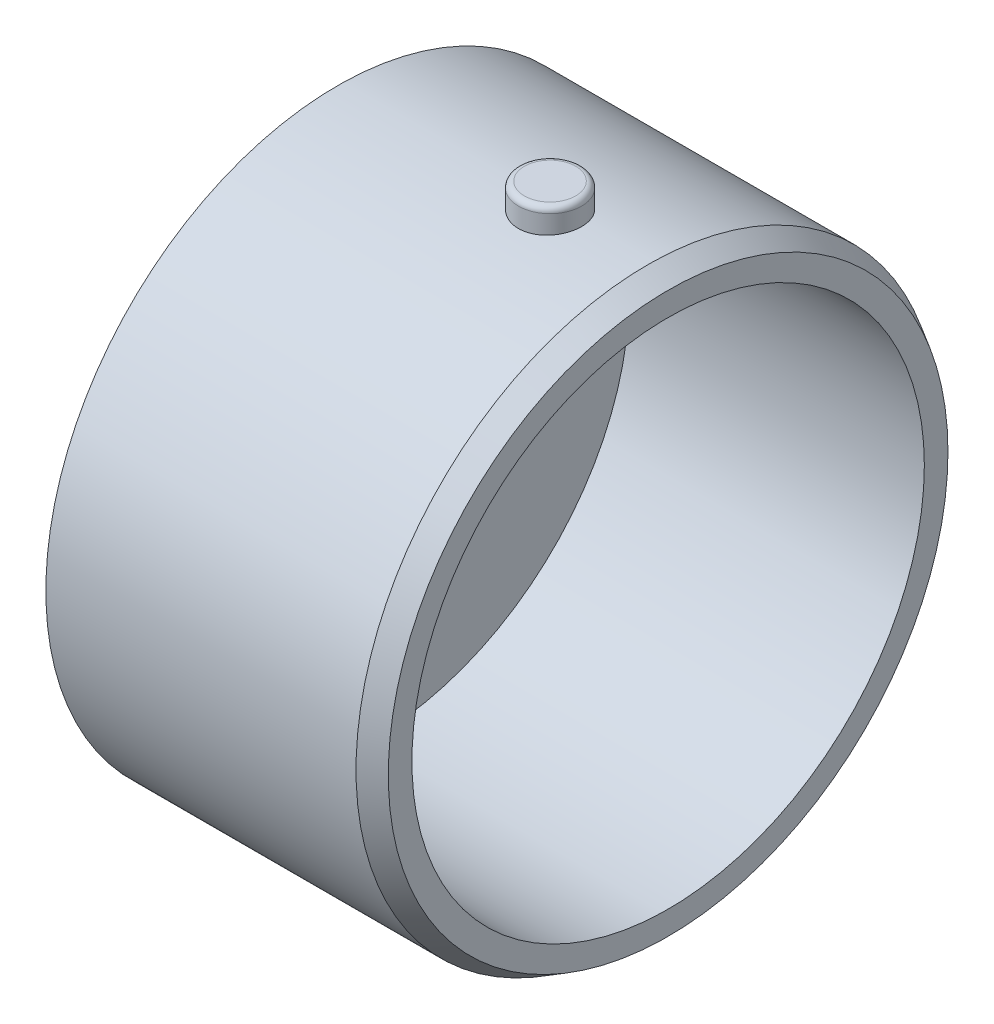
from build123d import *

# Parameters (mm, degrees)
SKETCH1_R                                    = 24.7
SKETCH1_R_2                                  = 21.7
BOSS_EXTRUDE1_DEPTH                          = 25
BOSS_EXTRUDE2_START                          = -3
SKETCH1_2_R                                  = 24.7
BOSS_EXTRUDE2_DEPTH                          = 3
FILLET1_R                                    = 0.5
CHAMFER1_SIZE                                = 1
CHAMFER1_SIZE2                               = 1.732050808
CSK_FOR_M5_COUNTERSUNK_FLAT_HEAD_SCR_2_COUNT = 2
CSK_FOR_M5_COUNTERSUNK_FLAT_HEAD_SCR_2_PITCH = 25
SKETCH7_W                                    = 1.730769231
SKETCH7_H                                    = 0.833333334
CUT_EXTRUDE1_DEPTH                           = 1


with BuildPart() as part:
    # Sketch1 → Boss-Extrude1 (new body)
    with BuildSketch(Plane.YZ):
        Circle(SKETCH1_R)
        Circle(SKETCH1_R_2, mode=Mode.SUBTRACT)
    extrude(amount=BOSS_EXTRUDE1_DEPTH)

    # Sketch1<2> → Boss-Extrude2 (add)
    with BuildSketch(Plane.YZ.offset(BOSS_EXTRUDE2_START)):
        Circle(SKETCH1_2_R)
    extrude(amount=BOSS_EXTRUDE2_DEPTH)

    # Sketch3 → Revolve1 (revolve)
    with BuildSketch(Plane(origin=(0, 0, 0), x_dir=(0, 1, 0), z_dir=(0, 0, 1))):
        Polygon((-26.7, -15), (-26.7, -17.675), (-24.7, -17.675), (-23.7, -17.675), (-23.7, -15), (-24.7, -15), align=None)
    revolve1 = revolve(axis=Axis((15, -32.98317824, 0), (0, 1, 0)))

    # Mirror1: Revolve1 across plane
    add(revolve1.mirror(Plane.ZX))

    # Fillet1
    fillet1_edges = [part.edges().sort_by_distance(p)[0] for p in [
        (12.325, 26.7, 0),
        (12.325, -26.7, 0),
    ]]
    fillet(fillet1_edges, radius=FILLET1_R)

    # Chamfer1
    chamfer1_edges = [part.edges().sort_by_distance(p)[0] for p in [
        (25, -24.7, 0),
    ]]
    chamfer1_side = [part.faces().sort_by_distance(p)[0] for p in [
        (25, -24.0013785, 0),
    ]]
    chamfer(chamfer1_edges, length=CHAMFER1_SIZE, length2=CHAMFER1_SIZE2, reference=chamfer1_side[0])

    # Sketch5 → CSK for M5 Countersunk Flat Head Screw1 (revolve, cut)
    with BuildSketch(Plane(origin=(0, -12.5, 0), x_dir=(0, 0, -1), z_dir=(0, 1, 0))):
        Polygon((0, 0), (0, 3), (2.125, 3), (2.125, 1.375), (3.5, 0), align=None)
    csk_for_m5_countersunk_flat_head_screw1 = revolve(axis=Axis((6.35, -12.5, 0), (-1, 0, 0)), mode=Mode.SUBTRACT)

    # CSK for M5 Countersunk Flat Head Scr 2: CSK for M5 Countersunk Flat Head Screw1 ×2
    with Locations(*[(0, i * CSK_FOR_M5_COUNTERSUNK_FLAT_HEAD_SCR_2_PITCH, 0) for i in range(1, CSK_FOR_M5_COUNTERSUNK_FLAT_HEAD_SCR_2_COUNT)]):
        add(csk_for_m5_countersunk_flat_head_screw1, mode=Mode.SUBTRACT)

    # Sketch7 → Cut-Extrude1 (cut)
    # profile 1 of 9: a face of its own
    with BuildSketch(Plane.YZ):
        Polygon((-14.943457021, 10), (-11.738328816, 10), (-11.738328816, 9.534254808), (-13.943857662, 4.871794872), (-14.738128495, 5.272435897), (-12.89618138, 9.166666667), (-14.943457021, 9.166666667), align=None)
    # profile 2 of 9: a face of its own
    with BuildSketch(Plane.YZ):
        with BuildLine():
            Line((-10.135764713, 8.782051282), (-11.033200611, 8.782051282))
            add(Edge.make_bspline(
                [(-11.033200611, 8.782051282), (-11.026864372, 8.826910901), (-11.014442596, 8.914855212), (-10.984718946, 9.042176667), (-10.949166254, 9.162949781), (-10.904780534, 9.276792089), (-10.852723305, 9.383906383), (-10.793523932, 9.484660227), (-10.726542447, 9.578621166), (-10.675200429, 9.635223608), (-10.649586829, 9.663461538)],
                knots=[0, 0, 0, 0, 1.111473889, 2.178970933, 3.205615836, 4.199322666, 5.174200091, 6.12565194, 7.064921805, 8, 8, 8, 8], degree=3))
            add(Edge.make_bspline(
                [(-10.649586829, 9.663461538), (-10.612642605, 9.700719441), (-10.539829422, 9.774150852), (-10.418150053, 9.868208379), (-10.290607603, 9.949608771), (-10.154644152, 10.014143591), (-10.012375395, 10.066377051), (-9.862669959, 10.101462385), (-9.706139597, 10.124741813), (-9.599327317, 10.127034918), (-9.5448192, 10.128205128)],
                knots=[0, 0, 0, 0, 1.01925491, 2.00884431, 2.983262333, 3.955970413, 4.92937149, 5.924503185, 6.940838805, 8, 8, 8, 8], degree=3))
            add(Edge.make_bspline(
                [(-9.5448192, 10.128205128), (-9.49635868, 10.12706107), (-9.401095062, 10.124812083), (-9.261081514, 10.106758433), (-9.127590313, 10.075094341), (-8.999210419, 10.033694252), (-8.87782988, 9.977362511), (-8.760769712, 9.911973351), (-8.651300579, 9.831770827), (-8.549166344, 9.741150047), (-8.45533657, 9.643134803), (-8.374079575, 9.538364567), (-8.304221478, 9.429637994), (-8.246667646, 9.316051772), (-8.20241657, 9.1974137), (-8.171705012, 9.074409134), (-8.151603551, 8.947309492), (-8.14960092, 8.860921577), (-8.148585226, 8.817107372)],
                knots=[0, 0, 0, 0, 1.091422571, 2.145516843, 3.172569842, 4.178562979, 5.178154469, 6.181868002, 7.194278174, 8.227918432, 9.254613415, 10.245994977, 11.209837596, 12.161663635, 13.10878368, 14.055455738, 15.013766427, 16, 16, 16, 16], degree=3))
            add(Edge.make_bspline(
                [(-8.148585226, 8.817107372), (-8.150669491, 8.762847127), (-8.154772767, 8.656025387), (-8.188443117, 8.499683833), (-8.241146372, 8.350193408), (-8.317281349, 8.209645707), (-8.412469462, 8.078423221), (-8.529262088, 7.960913113), (-8.664332671, 7.855272984), (-8.765731957, 7.798501965), (-8.817655739, 7.76943109)],
                knots=[0, 0, 0, 0, 0.992805628, 1.954529043, 2.915727527, 3.886831945, 4.871318353, 5.87440735, 6.911542536, 8, 8, 8, 8], degree=3))
            add(Edge.make_bspline(
                [(-8.817655739, 7.76943109), (-8.782016051, 7.75772983), (-8.711985664, 7.734737379), (-8.612445889, 7.689454008), (-8.517794937, 7.639966789), (-8.429662663, 7.582475686), (-8.347172486, 7.519305383), (-8.270827276, 7.44991588), (-8.200170886, 7.374458477), (-8.136356756, 7.292518186), (-8.079719221, 7.205405484), (-8.028901378, 7.115132622), (-7.98707546, 7.020330597), (-7.9516437, 6.92208211), (-7.924667975, 6.819504157), (-7.905674655, 6.712994218), (-7.894696049, 6.60279525), (-7.893021625, 6.528135516), (-7.89217497, 6.490384615)],
                knots=[0, 0, 0, 0, 1.059543567, 2.081955587, 3.086750234, 4.076226789, 5.052108497, 6.020845489, 6.989030705, 7.970690546, 8.952259656, 9.923888338, 10.895517021, 11.877585046, 12.873342345, 13.889638361, 14.932918083, 16, 16, 16, 16], degree=3))
            add(Edge.make_bspline(
                [(-7.89217497, 6.490384615), (-7.893891253, 6.434906119), (-7.897275414, 6.325513823), (-7.918790328, 6.164390166), (-7.958847221, 6.010773074), (-8.011544283, 5.862894951), (-8.081836444, 5.722664849), (-8.1645585, 5.586864679), (-8.266240528, 5.460203954), (-8.379242643, 5.339334092), (-8.504738079, 5.229444625), (-8.640795547, 5.134175403), (-8.784423262, 5.052417459), (-8.936529913, 4.986044031), (-9.097062657, 4.9349289), (-9.26566368, 4.897980528), (-9.443041397, 4.875374902), (-9.564115566, 4.873005131), (-9.625949008, 4.871794872)],
                knots=[0, 0, 0, 0, 1.005138573, 1.981928558, 2.936866704, 3.876260664, 4.820238198, 5.773547, 6.751179199, 7.756627054, 8.768222608, 9.766606018, 10.760583154, 11.757261445, 12.767156078, 13.807575856, 14.880313354, 16, 16, 16, 16], degree=3))
            add(Edge.make_bspline(
                [(-9.625949008, 4.871794872), (-9.684442447, 4.873070885), (-9.798818626, 4.875565961), (-9.966117726, 4.897162106), (-10.125119684, 4.931998439), (-10.276230277, 4.98110314), (-10.418864869, 5.044783546), (-10.554316927, 5.120612621), (-10.679883533, 5.212964009), (-10.796963749, 5.317668795), (-10.902960381, 5.43514162), (-10.997696408, 5.562661284), (-11.079082885, 5.700712692), (-11.147453578, 5.848706031), (-11.202273983, 6.006900926), (-11.245516158, 6.17497568), (-11.275721524, 6.353258657), (-11.284920632, 6.475921139), (-11.289610867, 6.538461538)],
                knots=[0, 0, 0, 0, 1.066544725, 2.085487077, 3.070979577, 4.031932826, 4.977951092, 5.916076795, 6.857635327, 7.814973522, 8.776389752, 9.738577119, 10.707772778, 11.69409279, 12.707140348, 13.757286496, 14.856535458, 16, 16, 16, 16], degree=3))
            Line((-11.289610867, 6.538461538), (-10.39217497, 6.538461538))
            add(Edge.make_bspline(
                [(-10.39217497, 6.538461538), (-10.386488012, 6.507015405), (-10.37541117, 6.445765812), (-10.35380647, 6.357090019), (-10.325652532, 6.275236784), (-10.293099575, 6.1994786), (-10.25793748, 6.128820787), (-10.215453261, 6.065872912), (-10.168759938, 6.008925684), (-10.101381133, 5.941226191), (-10.00505849, 5.871667788), (-9.874991011, 5.811218227), (-9.730303258, 5.775787358), (-9.629152089, 5.771464901), (-9.576870482, 5.769230769)],
                knots=[0, 0, 0, 0, 0.928156231, 1.807827665, 2.648129825, 3.438902246, 4.202261636, 4.936546065, 5.639352463, 6.338805438, 7.70633318, 9.064371875, 10.482673459, 12, 12, 12, 12], degree=3))
            add(Edge.make_bspline(
                [(-9.576870482, 5.769230769), (-9.549128014, 5.769706506), (-9.494786725, 5.770638369), (-9.414967464, 5.780966821), (-9.338928378, 5.797977789), (-9.266527842, 5.821095064), (-9.197304949, 5.850074014), (-9.132582272, 5.887440635), (-9.071040602, 5.930884667), (-9.013348951, 5.979727291), (-8.960040676, 6.032948268), (-8.915685057, 6.091881457), (-8.875147231, 6.151768111), (-8.845165162, 6.216526225), (-8.818894411, 6.282671121), (-8.802815369, 6.352603652), (-8.790674538, 6.42485682), (-8.789968962, 6.474303716), (-8.789610867, 6.499399038)],
                knots=[0, 0, 0, 0, 1.110435564, 2.175094844, 3.216326037, 4.226890168, 5.215276772, 6.21526065, 7.213097102, 8.228249917, 9.239874822, 10.221364777, 11.178138315, 12.128914389, 13.072518965, 14.022636769, 14.996447288, 16, 16, 16, 16], degree=3))
            add(Edge.make_bspline(
                [(-8.789610867, 6.499399038), (-8.790561541, 6.526845049), (-8.792454116, 6.581483766), (-8.807916646, 6.661217485), (-8.832335251, 6.737914897), (-8.866255675, 6.811236349), (-8.91155262, 6.880911593), (-8.965002511, 6.948338525), (-9.030816314, 7.010007694), (-9.10302287, 7.070965799), (-9.186754109, 7.124102882), (-9.277932202, 7.173140601), (-9.37895345, 7.212159487), (-9.487351834, 7.247010579), (-9.605177813, 7.272465275), (-9.731699729, 7.290947865), (-9.866713484, 7.304705289), (-9.95978022, 7.306679018), (-10.007559585, 7.307692308)],
                knots=[0, 0, 0, 0, 0.809814727, 1.612155564, 2.388397, 3.182215007, 3.988903953, 4.837162975, 5.715530372, 6.646997145, 7.623086902, 8.637258368, 9.698941581, 10.815059213, 11.996518529, 13.252603015, 14.589518788, 16, 16, 16, 16], degree=3))
            Line((-10.007559585, 7.307692308), (-10.007559585, 8.141025641))
            add(Edge.make_bspline(
                [(-10.007559585, 8.141025641), (-9.948071434, 8.146091842), (-9.836780885, 8.155569702), (-9.682303635, 8.177734005), (-9.552253704, 8.207360246), (-9.443505339, 8.243102701), (-9.353207664, 8.289005327), (-9.274324114, 8.339679798), (-9.20638587, 8.39853079), (-9.14896894, 8.463803375), (-9.103037182, 8.533900011), (-9.07052936, 8.607731188), (-9.049062892, 8.683012478), (-9.047028946, 8.734502611), (-9.046021124, 8.760016026)],
                knots=[0, 0, 0, 0, 1.70044513, 3.18119609, 4.440695891, 5.496282586, 6.431922213, 7.318171381, 8.16090191, 8.983045123, 9.787564368, 10.536848927, 11.275007137, 12, 12, 12, 12], degree=3))
            add(Edge.make_bspline(
                [(-9.046021124, 8.760016026), (-9.047759906, 8.792568372), (-9.05115364, 8.85610366), (-9.077511222, 8.947036042), (-9.123264997, 9.028094723), (-9.184612776, 9.099109134), (-9.259367178, 9.158425692), (-9.346992441, 9.201488502), (-9.445587093, 9.226789826), (-9.514953743, 9.229412721), (-9.550828816, 9.230769231)],
                knots=[0, 0, 0, 0, 1.009664648, 1.970651636, 2.907870547, 3.878035693, 4.867062054, 5.849714035, 6.887914197, 8, 8, 8, 8], degree=3))
            add(Edge.make_bspline(
                [(-9.550828816, 9.230769231), (-9.583345536, 9.229168692), (-9.647868669, 9.225992732), (-9.742220801, 9.202288212), (-9.831823892, 9.162384603), (-9.914822514, 9.107359877), (-9.990018566, 9.041277514), (-10.051732829, 8.963016672), (-10.103063828, 8.877266093), (-10.124821686, 8.813913975), (-10.135764713, 8.782051282)],
                knots=[0, 0, 0, 0, 0.98818071, 1.960853194, 2.938124878, 3.957524365, 4.978590984, 5.968022688, 6.978025184, 8, 8, 8, 8], degree=3))
        make_face()
    # profile 3 of 9: a face of its own
    with BuildSketch(Plane.YZ):
        with BuildLine():
            add(Edge.make_bspline(
                [(-4.731117277, 7.692307692), (-4.67868598, 7.654844114), (-4.574902956, 7.580688339), (-4.437843546, 7.447835497), (-4.319787611, 7.299636611), (-4.221974866, 7.137000703), (-4.143610246, 6.963925406), (-4.087513067, 6.782260688), (-4.051880783, 6.593608877), (-4.047988674, 6.465169462), (-4.046021124, 6.400240385)],
                knots=[0, 0, 0, 0, 1.013736912, 2.006600758, 2.994453809, 3.989973287, 4.987781207, 5.978959008, 6.978317308, 8, 8, 8, 8], degree=3))
            add(Edge.make_bspline(
                [(-4.046021124, 6.400240385), (-4.048394824, 6.329933622), (-4.053102753, 6.190489183), (-4.094727141, 5.985993933), (-4.161553425, 5.789532976), (-4.252884584, 5.603274741), (-4.367397059, 5.433007423), (-4.500871999, 5.282272324), (-4.65347766, 5.15500615), (-4.795557852, 5.068656873), (-4.917851238, 5.01129668), (-5.016540927, 4.974587308), (-5.120750751, 4.942269843), (-5.231224338, 4.916450332), (-5.347941597, 4.896293967), (-5.470735962, 4.882982741), (-5.599688262, 4.873306291), (-5.68762828, 4.872307173), (-5.732719841, 4.871794872)],
                knots=[0, 0, 0, 0, 1.313679292, 2.605514271, 3.884962679, 5.186178731, 6.472827995, 7.711026938, 8.938935107, 10.174644318, 10.808706728, 11.462743532, 12.142127587, 12.847854939, 13.582806024, 14.355735269, 15.156897313, 16, 16, 16, 16], degree=3))
            add(Edge.make_bspline(
                [(-5.732719841, 4.871794872), (-5.780805519, 4.872447133), (-5.874707366, 4.873720871), (-6.011783146, 4.881422565), (-6.141086101, 4.895621503), (-6.262887467, 4.914313305), (-6.377070058, 4.939047976), (-6.483637256, 4.970410184), (-6.582846379, 5.006119547), (-6.704283557, 5.060490117), (-6.843064229, 5.145401406), (-6.993061038, 5.26975154), (-7.12471986, 5.417856435), (-7.239184737, 5.585558808), (-7.329410268, 5.771826955), (-7.396504662, 5.970814524), (-7.436238756, 6.181982285), (-7.441022297, 6.326621819), (-7.443457021, 6.400240385)],
                knots=[0, 0, 0, 0, 0.886964665, 1.7320671, 2.531131818, 3.285397207, 4.004107883, 4.684213108, 5.332925796, 5.947568694, 7.135706876, 8.320776993, 9.52873045, 10.778999824, 12.05415135, 13.333578234, 14.642845846, 16, 16, 16, 16], degree=3))
            add(Edge.make_bspline(
                [(-7.443457021, 6.400240385), (-7.441232091, 6.464460472), (-7.436859834, 6.590660719), (-7.405540767, 6.775583994), (-7.351838083, 6.95091314), (-7.278149643, 7.117868726), (-7.183129651, 7.276469329), (-7.066216213, 7.425547961), (-6.928891674, 7.566449519), (-6.82475591, 7.649659088), (-6.7713817, 7.692307692)],
                knots=[0, 0, 0, 0, 1.01821053, 2.000906977, 2.963938143, 3.919209931, 4.888045165, 5.887808425, 6.917407893, 8, 8, 8, 8], degree=3))
            add(Edge.make_bspline(
                [(-6.7713817, 7.692307692), (-6.804470879, 7.730471219), (-6.869613507, 7.80560371), (-6.953908709, 7.926523466), (-7.024923867, 8.051191861), (-7.085219117, 8.178597146), (-7.129790903, 8.310932922), (-7.163497448, 8.446118599), (-7.182561837, 8.585531409), (-7.185541659, 8.679499787), (-7.187046765, 8.726963141)],
                knots=[0, 0, 0, 0, 1.061529281, 2.089831458, 3.092927091, 4.075998741, 5.048384512, 6.024008542, 7.00192825, 8, 8, 8, 8], degree=3))
            add(Edge.make_bspline(
                [(-7.187046765, 8.726963141), (-7.185051223, 8.79121453), (-7.181114098, 8.917980046), (-7.146243205, 9.103341161), (-7.088349056, 9.279471163), (-7.009588993, 9.445854372), (-6.909575954, 9.598864643), (-6.790738811, 9.736080652), (-6.651406948, 9.852476229), (-6.496761741, 9.952348772), (-6.326028037, 10.031786466), (-6.14082574, 10.087371015), (-5.943391194, 10.122558965), (-5.807325199, 10.126294443), (-5.737727854, 10.128205128)],
                knots=[0, 0, 0, 0, 1.022455555, 2.017265428, 2.990720743, 3.968117071, 4.939886797, 5.893155559, 6.847550415, 7.820889576, 8.817530429, 9.83499769, 10.892607882, 12, 12, 12, 12], degree=3))
            add(Edge.make_bspline(
                [(-5.737727854, 10.128205128), (-5.669132894, 10.126291316), (-5.535387083, 10.122559782), (-5.341422185, 10.087604988), (-5.160222145, 10.030782283), (-4.993285355, 9.949667304), (-4.840239481, 9.849602269), (-4.703275669, 9.729153906), (-4.58481144, 9.58852031), (-4.483968229, 9.431551708), (-4.403611686, 9.262440783), (-4.344204377, 9.085092869), (-4.309842488, 8.90090194), (-4.304911628, 8.77584499), (-4.30243138, 8.712940705)],
                knots=[0, 0, 0, 0, 1.094655142, 2.134348324, 3.136019022, 4.118575226, 5.088726318, 6.048298823, 7.020513804, 8.015920439, 9.020015034, 10.003048569, 10.995523219, 12, 12, 12, 12], degree=3))
            add(Edge.make_bspline(
                [(-4.30243138, 8.712940705), (-4.303626175, 8.668483358), (-4.305970871, 8.581239138), (-4.323307081, 8.452703781), (-4.35249913, 8.329373932), (-4.393199457, 8.208269218), (-4.449786805, 8.086098547), (-4.526362644, 7.960520908), (-4.619507096, 7.826318526), (-4.692658089, 7.738485809), (-4.731117277, 7.692307692)],
                knots=[0, 0, 0, 0, 0.940746401, 1.846144481, 2.739104268, 3.619506754, 4.545839139, 5.581956076, 6.728711598, 8, 8, 8, 8], degree=3))
        make_face()
        with BuildLine():
            add(Edge.make_bspline(
                [(-5.759763111, 9.230769231), (-5.796712421, 9.228987932), (-5.868586992, 9.225522912), (-5.971143589, 9.194247274), (-6.063345316, 9.143093743), (-6.143087487, 9.072696418), (-6.208480224, 8.987279809), (-6.256540292, 8.889075963), (-6.285040481, 8.779296825), (-6.28805778, 8.702427392), (-6.289610867, 8.662860577)],
                knots=[0, 0, 0, 0, 1.018099191, 1.980427864, 2.929421084, 3.909248076, 4.895556904, 5.880788387, 6.909183412, 8, 8, 8, 8], degree=3))
            add(Edge.make_bspline(
                [(-6.289610867, 8.662860577), (-6.28769233, 8.622955854), (-6.283946201, 8.545038035), (-6.254487104, 8.433149683), (-6.20427326, 8.331747017), (-6.135329992, 8.242948006), (-6.051552757, 8.170419541), (-5.957747935, 8.115026337), (-5.852875215, 8.083403793), (-5.779998738, 8.079115664), (-5.742735867, 8.076923077)],
                knots=[0, 0, 0, 0, 1.07118507, 2.091592095, 3.082435519, 4.092579768, 5.090825648, 6.043203473, 6.999459622, 8, 8, 8, 8], degree=3))
            add(Edge.make_bspline(
                [(-5.742735867, 8.076923077), (-5.704768522, 8.078621956), (-5.63080101, 8.081931691), (-5.525666436, 8.114374752), (-5.430953621, 8.166260815), (-5.349846088, 8.239616229), (-5.282664135, 8.3284474), (-5.23373707, 8.431622167), (-5.205576419, 8.54720201), (-5.201816873, 8.627981709), (-5.199867277, 8.669871795)],
                knots=[0, 0, 0, 0, 1.008803858, 1.965339183, 2.900766489, 3.864508618, 4.855158575, 5.849593072, 6.884859315, 8, 8, 8, 8], degree=3))
            add(Edge.make_bspline(
                [(-5.199867277, 8.669871795), (-5.201866189, 8.709412453), (-5.205732015, 8.785882696), (-5.233451465, 8.895668956), (-5.284359622, 8.992340074), (-5.351246373, 9.077226263), (-5.435104432, 9.145681695), (-5.532457497, 9.196024232), (-5.642588699, 9.225223391), (-5.719859166, 9.228880586), (-5.759763111, 9.230769231)],
                knots=[0, 0, 0, 0, 1.065910571, 2.061433587, 3.023559535, 3.990682701, 4.956464619, 5.918590567, 6.925120432, 8, 8, 8, 8], degree=3))
        make_face(mode=Mode.SUBTRACT)
        with BuildLine():
            add(Edge.make_bspline(
                [(-5.730716636, 7.179487179), (-5.758795315, 7.179020891), (-5.81413804, 7.178101843), (-5.895496393, 7.167503837), (-5.973568094, 7.151710186), (-6.048256283, 7.12992329), (-6.119183639, 7.10022227), (-6.18695139, 7.06441714), (-6.251325499, 7.022145957), (-6.311351115, 6.974176154), (-6.365600247, 6.921524725), (-6.414500904, 6.866610992), (-6.454470287, 6.808015286), (-6.487755253, 6.747685345), (-6.514499913, 6.685143089), (-6.532180153, 6.619358576), (-6.543563754, 6.55120787), (-6.545197181, 6.504786373), (-6.546021124, 6.481370192)],
                knots=[0, 0, 0, 0, 1.129580664, 2.226389355, 3.296443603, 4.333934503, 5.352185725, 6.386189251, 7.41493955, 8.447544828, 9.47401038, 10.455044306, 11.4018853, 12.322125673, 13.225630306, 14.132028716, 15.057747923, 16, 16, 16, 16], degree=3))
            add(Edge.make_bspline(
                [(-6.546021124, 6.481370192), (-6.545628418, 6.456949428), (-6.544849535, 6.408513865), (-6.533085603, 6.337818247), (-6.516147618, 6.269637179), (-6.492357677, 6.204608876), (-6.460543152, 6.142771198), (-6.422556031, 6.083522949), (-6.377071718, 6.027279587), (-6.325323507, 5.97434267), (-6.267391615, 5.926584121), (-6.204953731, 5.884508007), (-6.138834517, 5.847411552), (-6.067049121, 5.820693215), (-5.992256043, 5.796238246), (-5.912451553, 5.781402005), (-5.828507293, 5.770485087), (-5.771154324, 5.769656041), (-5.741734265, 5.769230769)],
                knots=[0, 0, 0, 0, 0.973817353, 1.931446211, 2.852767904, 3.776304432, 4.688323523, 5.623710549, 6.581246645, 7.570897993, 8.57436511, 9.572506873, 10.574556662, 11.591826551, 12.624694332, 13.712108235, 14.826391851, 16, 16, 16, 16], degree=3))
            add(Edge.make_bspline(
                [(-5.741734265, 5.769230769), (-5.711994961, 5.769769829), (-5.654042477, 5.770820287), (-5.569327598, 5.780104342), (-5.489202358, 5.794835437), (-5.413762462, 5.815904334), (-5.342722633, 5.84289443), (-5.277035808, 5.877247482), (-5.215202249, 5.916179049), (-5.159208983, 5.961662762), (-5.108083004, 6.011230516), (-5.064030796, 6.065552559), (-5.026573691, 6.122882091), (-4.996360454, 6.183838556), (-4.971981085, 6.248134217), (-4.955258368, 6.316410168), (-4.94488132, 6.387899147), (-4.943936884, 6.436595662), (-4.943457021, 6.461338141)],
                knots=[0, 0, 0, 0, 1.200705402, 2.339794563, 3.437264955, 4.487414319, 5.499029866, 6.500076882, 7.476298407, 8.444948224, 9.407950986, 10.347155707, 11.263432813, 12.167927724, 13.089546445, 14.03463663, 15.00140776, 16, 16, 16, 16], degree=3))
            add(Edge.make_bspline(
                [(-4.943457021, 6.461338141), (-4.944373277, 6.486404093), (-4.946164241, 6.535399342), (-4.95596413, 6.607752351), (-4.974347722, 6.676344134), (-4.998398831, 6.742765507), (-5.030392328, 6.805641992), (-5.070111562, 6.864840887), (-5.1153218, 6.921828619), (-5.16816258, 6.974068301), (-5.225935754, 7.021833938), (-5.287426091, 7.064387878), (-5.352444192, 7.100427141), (-5.421167902, 7.129887447), (-5.493848323, 7.151721523), (-5.569930899, 7.167503282), (-5.649290828, 7.178104215), (-5.703304722, 7.179021606), (-5.730716636, 7.179487179)],
                knots=[0, 0, 0, 0, 1.011708178, 1.977538892, 2.938094892, 3.871441737, 4.823268678, 5.775953079, 6.743660653, 7.753304209, 8.767430709, 9.76505158, 10.765940967, 11.761741361, 12.775867861, 13.822051386, 14.89469657, 16, 16, 16, 16], degree=3))
        make_face(mode=Mode.SUBTRACT)
    # profile 4 of 9: a face of its own
    with BuildSketch(Plane.YZ):
        with BuildLine():
            Line((-2.635764713, 8.333333333), (-3.533200611, 8.333333333))
            add(Edge.make_bspline(
                [(-3.533200611, 8.333333333), (-3.529324723, 8.401219611), (-3.52175147, 8.533865322), (-3.491626986, 8.726537465), (-3.451261211, 8.908591452), (-3.397387726, 9.07939044), (-3.329692167, 9.238872366), (-3.249916515, 9.387580911), (-3.156022683, 9.524733123), (-3.050009042, 9.649667576), (-2.93367541, 9.761747427), (-2.809436989, 9.861124464), (-2.675393385, 9.943127893), (-2.533993683, 10.010609124), (-2.385261961, 10.064523492), (-2.227790983, 10.100569609), (-2.062944219, 10.124980393), (-1.950093261, 10.127116435), (-1.892575611, 10.128205128)],
                knots=[0, 0, 0, 0, 1.199038563, 2.342849363, 3.436047546, 4.486744587, 5.497670872, 6.488682221, 7.459191391, 8.424610317, 9.374430501, 10.305433194, 11.225809216, 12.140057399, 13.06607119, 14.010487599, 14.985989317, 16, 16, 16, 16], degree=3))
            add(Edge.make_bspline(
                [(-1.892575611, 10.128205128), (-1.821973511, 10.126002157), (-1.684141668, 10.12170144), (-1.483861067, 10.085014898), (-1.296820884, 10.023650986), (-1.123157079, 9.93790942), (-0.964348082, 9.828983747), (-0.82042023, 9.699107709), (-0.695726129, 9.545556439), (-0.589475182, 9.374718953), (-0.501193343, 9.1938261), (-0.439329109, 9.006775389), (-0.398666413, 8.818530386), (-0.394329485, 8.691775729), (-0.39217497, 8.62880609)],
                knots=[0, 0, 0, 0, 1.075374347, 2.099382735, 3.09057751, 4.06680945, 5.040638231, 6.016817125, 7.011024321, 8.044445721, 9.0776792, 10.070479129, 11.0414456, 12, 12, 12, 12], degree=3))
            add(Edge.make_bspline(
                [(-0.39217497, 8.62880609), (-0.393013824, 8.590717601), (-0.394702231, 8.514054882), (-0.406441946, 8.398045373), (-0.424053839, 8.279876124), (-0.450608281, 8.159648455), (-0.483723848, 8.037328665), (-0.523897817, 7.912550691), (-0.572062062, 7.78602198), (-0.627412821, 7.656318473), (-0.693446417, 7.523019073), (-0.770333361, 7.38412557), (-0.860114406, 7.239761173), (-0.961705111, 7.089110755), (-1.075598878, 6.932411914), (-1.202351698, 6.770136676), (-1.340503676, 6.601713235), (-1.438554021, 6.489131617), (-1.488929777, 6.431290064)],
                knots=[0, 0, 0, 0, 0.728284026, 1.46585585, 2.227944881, 3.01186502, 3.81876927, 4.650621989, 5.517437689, 6.406905708, 7.346299482, 8.360816762, 9.441613733, 10.596154504, 11.834900912, 13.145207542, 14.533280747, 16, 16, 16, 16], degree=3))
            Line((-1.488929777, 6.431290064), (-2.010764713, 5.833333333))
            Line((-2.010764713, 5.833333333), (-0.328072406, 5.833333333))
            Line((-0.328072406, 5.833333333), (-0.328072406, 5))
            Line((-0.328072406, 5), (-3.661405739, 5))
            Line((-3.661405739, 5), (-3.661405739, 5.454727564))
            Line((-3.661405739, 5.454727564), (-2.181037149, 7.030248397))
            add(Edge.make_bspline(
                [(-2.181037149, 7.030248397), (-2.138176674, 7.076206829), (-2.055168645, 7.165214683), (-1.937056773, 7.295932185), (-1.830175963, 7.419979974), (-1.736742475, 7.53867891), (-1.651853039, 7.64817888), (-1.579292869, 7.751780352), (-1.518398096, 7.848546731), (-1.452288183, 7.965230084), (-1.389505497, 8.104395745), (-1.331898583, 8.264720294), (-1.296783183, 8.417953638), (-1.291936147, 8.51780378), (-1.289610867, 8.565705128)],
                knots=[0, 0, 0, 0, 1.246127091, 2.413378631, 3.493388633, 4.492180848, 5.408488754, 6.240484944, 6.999099869, 7.674939598, 8.898438119, 10.020720584, 11.050475521, 12, 12, 12, 12], degree=3))
            add(Edge.make_bspline(
                [(-1.289610867, 8.565705128), (-1.291349423, 8.612045987), (-1.294718153, 8.701838832), (-1.331737772, 8.829568675), (-1.38908985, 8.945215009), (-1.469907027, 9.045322191), (-1.567801941, 9.127586901), (-1.680928709, 9.188773081), (-1.808365016, 9.224077226), (-1.897700295, 9.228496044), (-1.943657341, 9.230769231)],
                knots=[0, 0, 0, 0, 1.062038974, 2.057870785, 3.028805853, 4.01125022, 4.991535629, 5.949134679, 6.94496649, 8, 8, 8, 8], degree=3))
            add(Edge.make_bspline(
                [(-1.943657341, 9.230769231), (-1.967399337, 9.229929488), (-2.014139268, 9.22827632), (-2.082843314, 9.217271627), (-2.148220149, 9.197877005), (-2.210997455, 9.17189094), (-2.270505255, 9.137446225), (-2.326593453, 9.094987626), (-2.379853007, 9.045594113), (-2.430039648, 8.989420132), (-2.475716043, 8.926729953), (-2.51628565, 8.858096122), (-2.549829962, 8.783561243), (-2.579363593, 8.704109289), (-2.602141342, 8.618886882), (-2.618726369, 8.528404068), (-2.631334858, 8.432808052), (-2.634261233, 8.36709478), (-2.635764713, 8.333333333)],
                knots=[0, 0, 0, 0, 0.903469896, 1.778625579, 2.63899355, 3.493148037, 4.358286772, 5.247621495, 6.164656832, 7.118446693, 8.109501108, 9.111810964, 10.146451449, 11.215617525, 12.33435995, 13.498009769, 14.714554818, 16, 16, 16, 16], degree=3))
        make_face()
    # profile 5 of 9: a face of its own
    with BuildSketch(Plane.YZ):
        with Locations((1.498850672, 6.826923077)):
            Rectangle(SKETCH7_W, SKETCH7_H)
    # profile 6 of 9: a face of its own
    with BuildSketch(Plane.YZ):
        Polygon((5.147688812, 10.128205128), (6.082184005, 10.128205128), (6.082184005, 6.858974359), (6.530901953, 6.858974359), (6.530901953, 6.025641026), (6.082184005, 6.025641026), (6.082184005, 5), (5.184748107, 5), (5.184748107, 6.025641026), (3.069363492, 6.025641026), (3.069363492, 6.934094551), align=None)
        Polygon((5.184748107, 6.858974359), (5.184748107, 8.560697115), (4.077977274, 6.858974359), align=None, mode=Mode.SUBTRACT)
    # profile 7 of 9: a face of its own
    with BuildSketch(Plane.YZ):
        with BuildLine():
            Line((8.602216056, 4.871794872), (7.80694362, 5.272435897))
            Line((7.80694362, 5.272435897), (8.678337851, 6.987179487))
            add(Edge.make_bspline(
                [(8.678337851, 6.987179487), (8.626853879, 6.988491745), (8.525778387, 6.991068025), (8.37695261, 7.012476888), (8.234634102, 7.049023183), (8.097145397, 7.097675509), (7.966387921, 7.162898994), (7.840776134, 7.2407398), (7.722048929, 7.334264409), (7.609649643, 7.439389937), (7.507025502, 7.555587673), (7.417949919, 7.680556372), (7.340310302, 7.811125943), (7.279933478, 7.95024409), (7.231438506, 8.095317996), (7.196005633, 8.247098579), (7.176121643, 8.406251754), (7.173342424, 8.514569665), (7.171927594, 8.569711538)],
                knots=[0, 0, 0, 0, 1.014336294, 1.991387562, 2.955278539, 3.906441712, 4.859855302, 5.829322156, 6.813833455, 7.833278715, 8.858926674, 9.863225732, 10.85404919, 11.846815163, 12.845559416, 13.865450493, 14.913355531, 16, 16, 16, 16], degree=3))
            add(Edge.make_bspline(
                [(7.171927594, 8.569711538), (7.173239926, 8.623198612), (7.175825847, 8.728593785), (7.197302175, 8.883279599), (7.232646652, 9.031800579), (7.281138008, 9.174131495), (7.345692342, 9.309312583), (7.421251548, 9.439460467), (7.513619249, 9.561882526), (7.617963327, 9.677108726), (7.732162383, 9.782520354), (7.853317996, 9.875202936), (7.980879288, 9.952676668), (8.11320697, 10.017740311), (8.252692962, 10.066351817), (8.397321534, 10.103028839), (8.548170075, 10.124196722), (8.650562918, 10.126858301), (8.702376312, 10.128205128)],
                knots=[0, 0, 0, 0, 1.055538678, 2.079917126, 3.075849687, 4.065898488, 5.041806164, 6.028602842, 7.031727914, 8.062953097, 9.093756959, 10.095582084, 11.068815425, 12.035667573, 13.000833448, 13.979119574, 14.977382875, 16, 16, 16, 16], degree=3))
            add(Edge.make_bspline(
                [(8.702376312, 10.128205128), (8.756553484, 10.12708995), (8.863085562, 10.124897102), (9.019034218, 10.100699893), (9.16823958, 10.063576949), (9.311307893, 10.013156417), (9.446463024, 9.944725319), (9.574835883, 9.862710172), (9.69599946, 9.765296336), (9.808652548, 9.655291581), (9.911109272, 9.535640827), (10.001924409, 9.410395353), (10.07821298, 9.279800049), (10.140697986, 9.145020433), (10.189373492, 9.005845356), (10.222831698, 8.862077405), (10.245044236, 8.713962428), (10.24757158, 8.613529528), (10.248850671, 8.562700321)],
                knots=[0, 0, 0, 0, 1.062826075, 2.08990367, 3.089830715, 4.078784409, 5.060762809, 6.057138927, 7.064407536, 8.107320944, 9.143871033, 10.153461498, 11.140480137, 12.108246174, 13.065926856, 14.029354859, 15.002654194, 16, 16, 16, 16], degree=3))
            add(Edge.make_bspline(
                [(10.248850671, 8.562700321), (10.248152659, 8.523934091), (10.246746706, 8.445850187), (10.232922304, 8.328754911), (10.211947901, 8.211335092), (10.187602667, 8.112614148), (10.162080076, 8.029398388), (10.137243688, 7.958805248), (10.105377871, 7.880433609), (10.069796501, 7.793758163), (10.028589088, 7.699158992), (9.98090127, 7.597088316), (9.929615169, 7.486032327), (9.89181225, 7.410093755), (9.872248107, 7.370793269)],
                knots=[0, 0, 0, 0, 1.105131805, 2.225983929, 3.357782449, 4.505488967, 5.122909461, 5.839607681, 6.638776516, 7.535249922, 8.51168636, 9.581005249, 10.748097757, 12, 12, 12, 12], degree=3))
            Line((9.872248107, 7.370793269), (8.602216056, 4.871794872))
        make_face()
        with BuildLine():
            add(Edge.make_bspline(
                [(8.722408364, 7.820512821), (8.765409753, 7.823044437), (8.849424731, 7.827990642), (8.97010666, 7.866235755), (9.078110851, 7.931683529), (9.173838885, 8.018631769), (9.252945603, 8.1247126), (9.310461364, 8.245476195), (9.345889302, 8.378421675), (9.34953757, 8.470996018), (9.351414774, 8.518629808)],
                knots=[0, 0, 0, 0, 0.984774978, 1.924027336, 2.867853169, 3.859505234, 4.871392407, 5.881338128, 6.909850265, 8, 8, 8, 8], degree=3))
            add(Edge.make_bspline(
                [(9.351414774, 8.518629808), (9.349153887, 8.56725449), (9.344755922, 8.661841108), (9.308988599, 8.797977789), (9.247869438, 8.921037274), (9.164720315, 9.028009856), (9.067644799, 9.117532242), (8.959089868, 9.182925933), (8.841691463, 9.223363296), (8.760447658, 9.22828354), (8.719403556, 9.230769231)],
                knots=[0, 0, 0, 0, 1.104110315, 2.147758178, 3.172670271, 4.206310416, 5.210906102, 6.157051016, 7.068948237, 8, 8, 8, 8], degree=3))
            add(Edge.make_bspline(
                [(8.719403556, 9.230769231), (8.676022243, 9.228346003), (8.590843391, 9.223588015), (8.468662542, 9.183247759), (8.356030979, 9.119109844), (8.257672395, 9.029283714), (8.172546812, 8.923719926), (8.113186419, 8.80024506), (8.075632976, 8.665058394), (8.071490896, 8.570302153), (8.069363492, 8.521634615)],
                knots=[0, 0, 0, 0, 0.970967322, 1.90648639, 2.855811969, 3.858352357, 4.877096915, 5.878517833, 6.91039038, 8, 8, 8, 8], degree=3))
            add(Edge.make_bspline(
                [(8.069363492, 8.521634615), (8.071585697, 8.473660798), (8.075907655, 8.380356733), (8.112130053, 8.246657267), (8.171132711, 8.12525458), (8.251793553, 8.018337152), (8.351147847, 7.930960508), (8.463956999, 7.866209885), (8.589792998, 7.82788694), (8.6774075, 7.823015108), (8.722408364, 7.820512821)],
                knots=[0, 0, 0, 0, 1.075706617, 2.092137047, 3.084482865, 4.090466434, 5.0784141, 6.035155512, 6.990809768, 8, 8, 8, 8], degree=3))
        make_face(mode=Mode.SUBTRACT)
    # profile 8 of 9: a face of its own
    with BuildSketch(Plane.YZ):
        Polygon((11.746246505, 10), (13.133466056, 10), (13.133466056, 5), (12.236030159, 5), (12.236030159, 9.166666667), (11.210389133, 9.166666667), align=None)
    # profile 9 of 9: a face of its own
    with BuildSketch(Plane.YZ):
        with BuildLine():
            Line((16.446767338, 10.128205128), (17.242039774, 9.724559295))
            Line((17.242039774, 9.724559295), (16.370645543, 8.012820513))
            add(Edge.make_bspline(
                [(16.370645543, 8.012820513), (16.422129438, 8.011508157), (16.523204779, 8.008931685), (16.672031652, 7.987524217), (16.8143461, 7.950972752), (16.951849756, 7.902339464), (17.082551135, 7.83704455), (17.208552615, 7.759367952), (17.326595183, 7.664634355), (17.439385258, 7.559674205), (17.541944704, 7.44339354), (17.631035713, 7.318446246), (17.708676954, 7.187872337), (17.769032131, 7.048750549), (17.817716626, 6.903386986), (17.852844632, 6.751200566), (17.872886142, 6.591750593), (17.875649198, 6.483429003), (17.8770558, 6.428285256)],
                knots=[0, 0, 0, 0, 1.013672955, 1.990085268, 2.953345895, 3.903887042, 4.856677135, 5.825509993, 6.813434118, 7.832212698, 8.85718992, 9.860832204, 10.8510077, 11.84312444, 12.841215551, 13.86684641, 14.914066156, 16, 16, 16, 16], degree=3))
            add(Edge.make_bspline(
                [(17.8770558, 6.428285256), (17.875737698, 6.37513003), (17.873132376, 6.270064941), (17.85159594, 6.115751046), (17.816791929, 5.967695889), (17.767050009, 5.826195153), (17.703824004, 5.690557179), (17.626502884, 5.560861561), (17.534445419, 5.438077471), (17.430030119, 5.322857325), (17.315886184, 5.21783331), (17.195572259, 5.124481853), (17.06806882, 5.047370009), (16.93578583, 4.982247248), (16.796287878, 4.933651561), (16.65166256, 4.896970235), (16.500813138, 4.875803518), (16.398420415, 4.87314178), (16.346607082, 4.871794872)],
                knots=[0, 0, 0, 0, 1.049934834, 2.075270938, 3.072134561, 4.05064612, 5.033440221, 6.024524368, 7.028587226, 8.060776465, 9.092543989, 10.090062252, 11.064205434, 12.031961459, 12.998029633, 13.977230324, 14.976426867, 16, 16, 16, 16], degree=3))
            add(Edge.make_bspline(
                [(16.346607082, 4.871794872), (16.29242608, 4.872900208), (16.185886472, 4.875073701), (16.029992361, 4.899411096), (15.880476491, 4.936047651), (15.738179167, 4.988358428), (15.602215483, 5.054966279), (15.474186166, 5.137386796), (15.353012746, 5.234711101), (15.239987111, 5.344749551), (15.138159436, 5.465281616), (15.047337661, 5.590425282), (14.970502322, 5.720376925), (14.908305906, 5.854997603), (14.85977882, 5.993858341), (14.826013866, 6.137222686), (14.804012882, 6.284710363), (14.801433769, 6.384803846), (14.800132723, 6.435296474)],
                knots=[0, 0, 0, 0, 1.063775006, 2.091769615, 3.092589432, 4.084662827, 5.064601646, 6.061867366, 7.070035304, 8.113879863, 9.156342271, 10.166834137, 11.149076039, 12.117706134, 13.076241869, 14.034148791, 15.008317125, 16, 16, 16, 16], degree=3))
            add(Edge.make_bspline(
                [(14.800132723, 6.435296474), (14.80082017, 6.474397108), (14.802198891, 6.552816025), (14.816054211, 6.670244093), (14.837119164, 6.787980397), (14.861536202, 6.88733002), (14.886678402, 6.971340522), (14.911984219, 7.042436341), (14.943345203, 7.121337153), (14.979195454, 7.208244441), (15.02066233, 7.303053654), (15.067529218, 7.405506368), (15.119912793, 7.516378432), (15.157269497, 7.592530371), (15.176735287, 7.632211538)],
                knots=[0, 0, 0, 0, 1.110454016, 2.227089276, 3.35462975, 4.507227546, 5.131400587, 5.845402449, 6.650387134, 7.543487832, 8.516250726, 9.590168902, 10.744287919, 12, 12, 12, 12], degree=3))
            Line((15.176735287, 7.632211538), (16.446767338, 10.128205128))
        make_face()
        with BuildLine():
            add(Edge.make_bspline(
                [(16.32657503, 7.179487179), (16.283513325, 7.17751203), (16.199247219, 7.173646922), (16.079433419, 7.133169627), (15.970190417, 7.069670825), (15.875497232, 6.981236464), (15.796295096, 6.87555393), (15.738094587, 6.755008883), (15.703083747, 6.621209964), (15.699446345, 6.527659991), (15.69756862, 6.479366987)],
                knots=[0, 0, 0, 0, 0.981744412, 1.921144944, 2.858899012, 3.85339082, 4.86292663, 5.863643845, 6.897155691, 8, 8, 8, 8], degree=3))
            add(Edge.make_bspline(
                [(15.69756862, 6.479366987), (15.699791905, 6.431057902), (15.704116342, 6.337093501), (15.740443636, 6.202020578), (15.799922688, 6.078738093), (15.883338265, 5.971655035), (15.981266954, 5.882767807), (16.089858256, 5.817031452), (16.207300826, 5.776647451), (16.288538721, 5.771720067), (16.329579838, 5.769230769)],
                knots=[0, 0, 0, 0, 1.098279937, 2.136227893, 3.159405121, 4.194678092, 5.206500211, 6.154139736, 7.067477469, 8, 8, 8, 8], degree=3))
            add(Edge.make_bspline(
                [(16.329579838, 5.769230769), (16.372923896, 5.771764404), (16.457929123, 5.7767333), (16.580554737, 5.815418016), (16.692573971, 5.880053072), (16.791620642, 5.96865572), (16.87669985, 6.074516816), (16.935566069, 6.198523445), (16.97357279, 6.334571277), (16.977559004, 6.430019605), (16.979619902, 6.479366987)],
                knots=[0, 0, 0, 0, 0.96921794, 1.900804717, 2.848419905, 3.844199796, 4.861108892, 5.867439427, 6.897452859, 8, 8, 8, 8], degree=3))
            add(Edge.make_bspline(
                [(16.979619902, 6.479366987), (16.977272163, 6.527631793), (16.972725492, 6.621102226), (16.938574605, 6.755527962), (16.877600503, 6.875608383), (16.796606355, 6.981672705), (16.698654333, 7.070067633), (16.585039204, 7.133670398), (16.459752109, 7.173575209), (16.371614633, 7.17748779), (16.32657503, 7.179487179)],
                knots=[0, 0, 0, 0, 1.083229974, 2.097801324, 3.086792542, 4.086858909, 5.079819718, 6.026392613, 6.991456328, 8, 8, 8, 8], degree=3))
        make_face(mode=Mode.SUBTRACT)
    extrude(amount=-CUT_EXTRUDE1_DEPTH, mode=Mode.SUBTRACT)


solid = part.part
